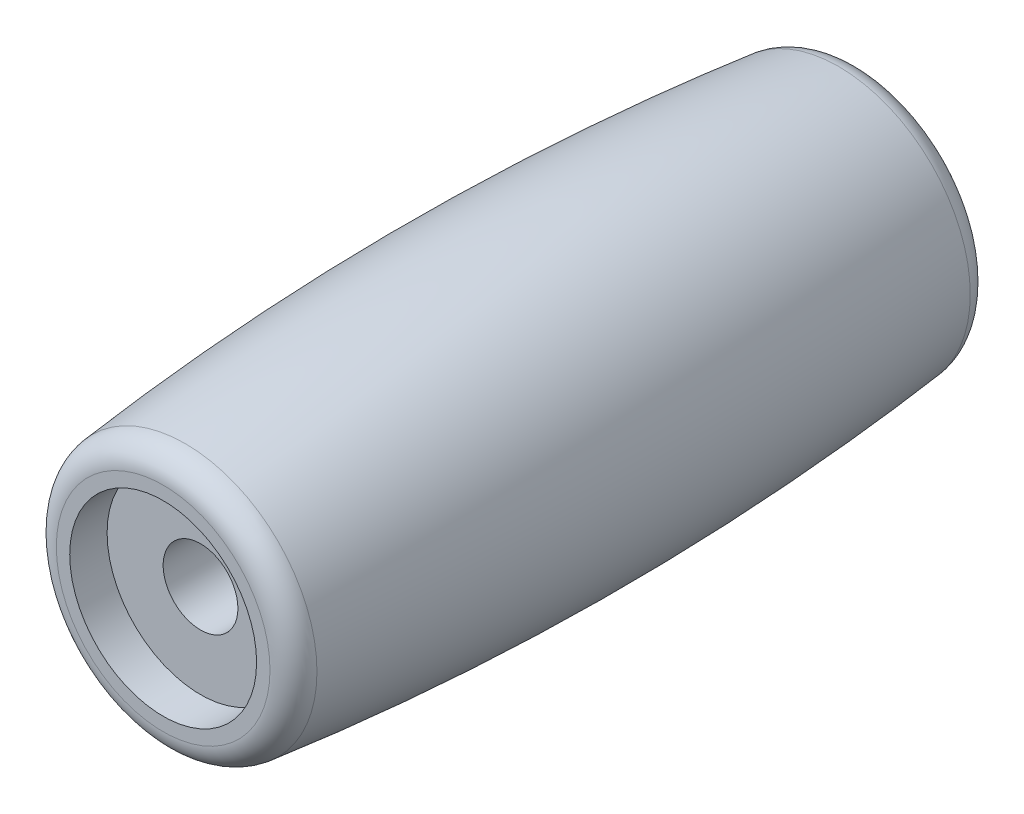
from build123d import *


with BuildPart() as part:
    # 草图2 → 旋转1 (revolve)
    with BuildSketch(Plane(origin=(0, 0, 0), x_dir=(0, 0, -1), z_dir=(1, 0, 0)), mode=Mode.PRIVATE) as revolve_1_sk:
        with BuildLine():
            Line((-8.648061997, 1.5), (16.351938003, 1.5))
            Line((16.351938003, 1.5), (16.351938003, 3.75))
            Line((16.351938003, 3.75), (17.851938003, 3.75))
            Line((17.851938003, 3.75), (17.851938003, 4.287784661))
            ThreePointArc((17.851938003, 4.287784661), (17.596667382, 4.95515124), (16.9611817, 5.281799658))
            ThreePointArc((16.9611817, 5.281799658), (3.851938003, 6), (-9.257305695, 5.281799658))
            ThreePointArc((-9.257305695, 5.281799658), (-9.892791377, 4.95515124), (-10.148061997, 4.287784661))
            Line((-10.148061997, 4.287784661), (-10.148061997, 3.75))
            Line((-10.148061997, 3.75), (-8.648061997, 3.75))
            Line((-8.648061997, 3.75), (-8.648061997, 1.5))
        make_face()
    revolve(revolve_1_sk.sketch.rotate(Axis((0, 0, -3.851938003), (0, 0, -1)), 90), axis=Axis((0, 0, -3.851938003), (0, 0, -1)))


solid = part.part
